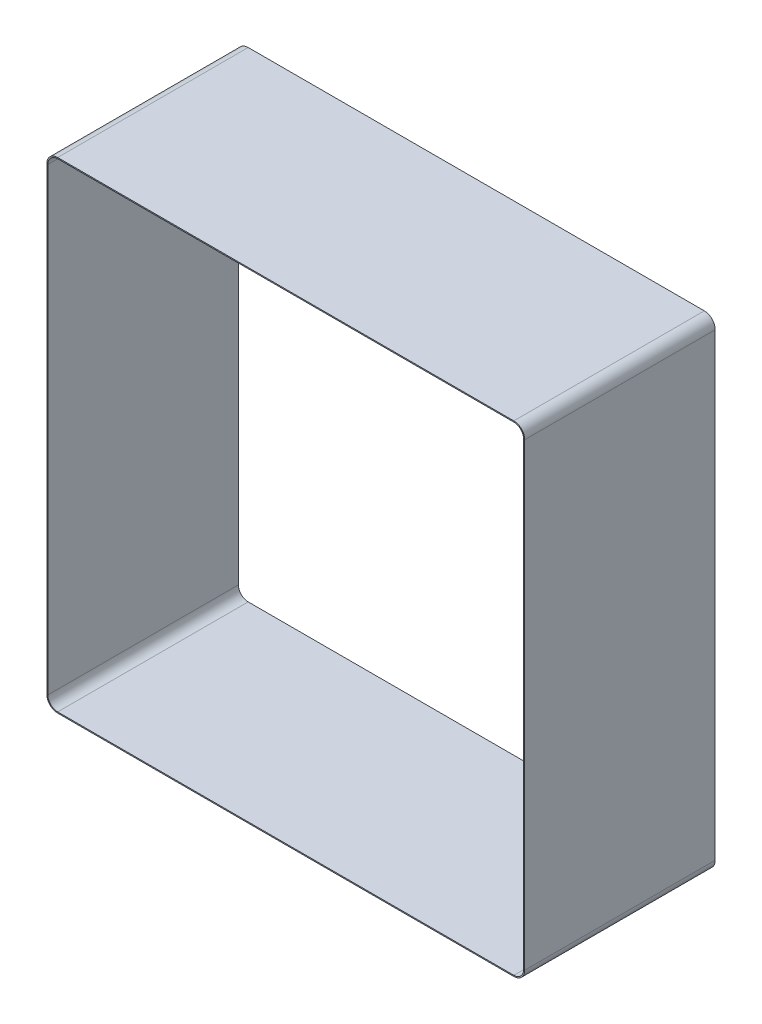
from build123d import *

# Parameters (mm, degrees)
BOSS_EXTRUDE1_DEPTH = 44.45


with BuildPart() as part:
    # Sketch1 → Boss-Extrude1 (new body)
    with BuildSketch(Plane.XY):
        with BuildLine():
            Line((-53.213, 56.134), (53.213, 56.134))
            ThreePointArc((53.213, 56.134), (55.009051224, 55.390051224), (55.753, 53.594))
            Line((55.753, 53.594), (55.753, -53.594))
            ThreePointArc((55.753, -53.594), (55.009051224, -55.390051224), (53.213, -56.134))
            Line((53.213, -56.134), (-53.213, -56.134))
            ThreePointArc((-53.213, -56.134), (-55.009051224, -55.390051224), (-55.753, -53.594))
            Line((-55.753, -53.594), (-55.753, 53.594))
            ThreePointArc((-55.753, 53.594), (-55.009051224, 55.390051224), (-53.213, 56.134))
        make_face()
        with BuildLine():
            Line((-55.499, 53.594), (-55.499, -53.594))
            ThreePointArc((-55.499, -53.594), (-54.829446102, -55.210446102), (-53.213, -55.88))
            Line((-53.213, -55.88), (53.213, -55.88))
            ThreePointArc((53.213, -55.88), (54.829446102, -55.210446102), (55.499, -53.594))
            Line((55.499, -53.594), (55.499, 53.594))
            ThreePointArc((55.499, 53.594), (54.829446102, 55.210446102), (53.213, 55.88))
            Line((53.213, 55.88), (-53.213, 55.88))
            ThreePointArc((-53.213, 55.88), (-54.829446102, 55.210446102), (-55.499, 53.594))
        make_face(mode=Mode.SUBTRACT)
    extrude(amount=BOSS_EXTRUDE1_DEPTH)


solid = part.part
